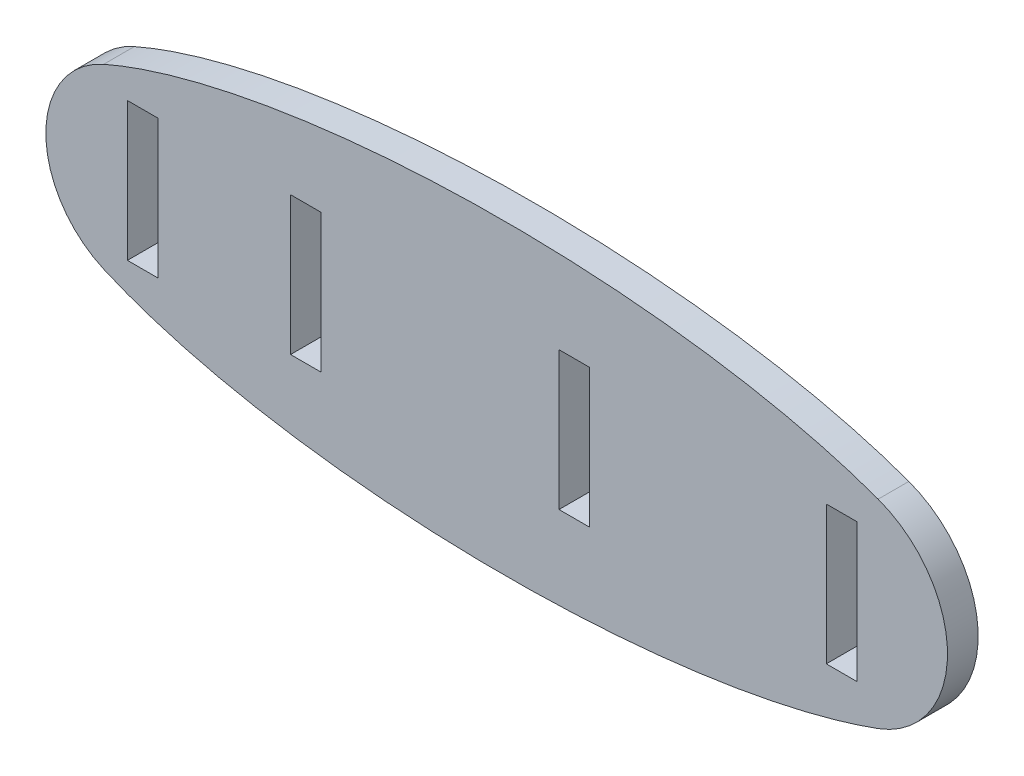
from build123d import *

# Parameters (mm, degrees)
SKETCH1_W           = 1.5875
SKETCH1_H           = 7.1628
BOSS_EXTRUDE1_DEPTH = 1.5875


with BuildPart() as part:
    # Sketch1 → Boss-Extrude1 (new body)
    with BuildSketch(Plane.XY):
        with BuildLine():
            ThreePointArc((-20.722796249, 4.589876297), (-23.715296357, 7.4e-08), (-20.722796383, -4.589876237))
            add(Edge.make_bspline(
                [(-20.722796383, -4.589876237), (-1.820130831, -12.924202126), (19.352380946, -5.14103201)],
                knots=[3.758177337, 3.758177337, 3.758177337, 5.578637888, 5.578637888, 5.578637888], degree=2, weights=[1, 0.61356393, 1]))
            ThreePointArc((19.352380946, -5.14103201), (22.939895377, 0), (19.352380946, 5.14103201))
            add(Edge.make_bspline(
                [(19.352380946, 5.14103201), (-1.82013063, 12.924202052), (-20.722796249, 4.589876297)],
                knots=[0.704547419, 0.704547419, 0.704547419, 2.525007961, 2.525007961, 2.525007961], degree=2, weights=[1, 0.613563933, 1]))
        make_face()
        with Locations((-18.699085792, 0)):
            Rectangle(SKETCH1_W, SKETCH1_H, mode=Mode.SUBTRACT)
        with Locations((3.632105004, 0)):
            Rectangle(SKETCH1_W, SKETCH1_H, mode=Mode.SUBTRACT)
        with Locations((-10.258658934, 0)):
            Rectangle(SKETCH1_W, SKETCH1_H, mode=Mode.SUBTRACT)
        with Locations((17.4625, 0)):
            Rectangle(SKETCH1_W, SKETCH1_H, mode=Mode.SUBTRACT)
    extrude(amount=BOSS_EXTRUDE1_DEPTH)


solid = part.part
